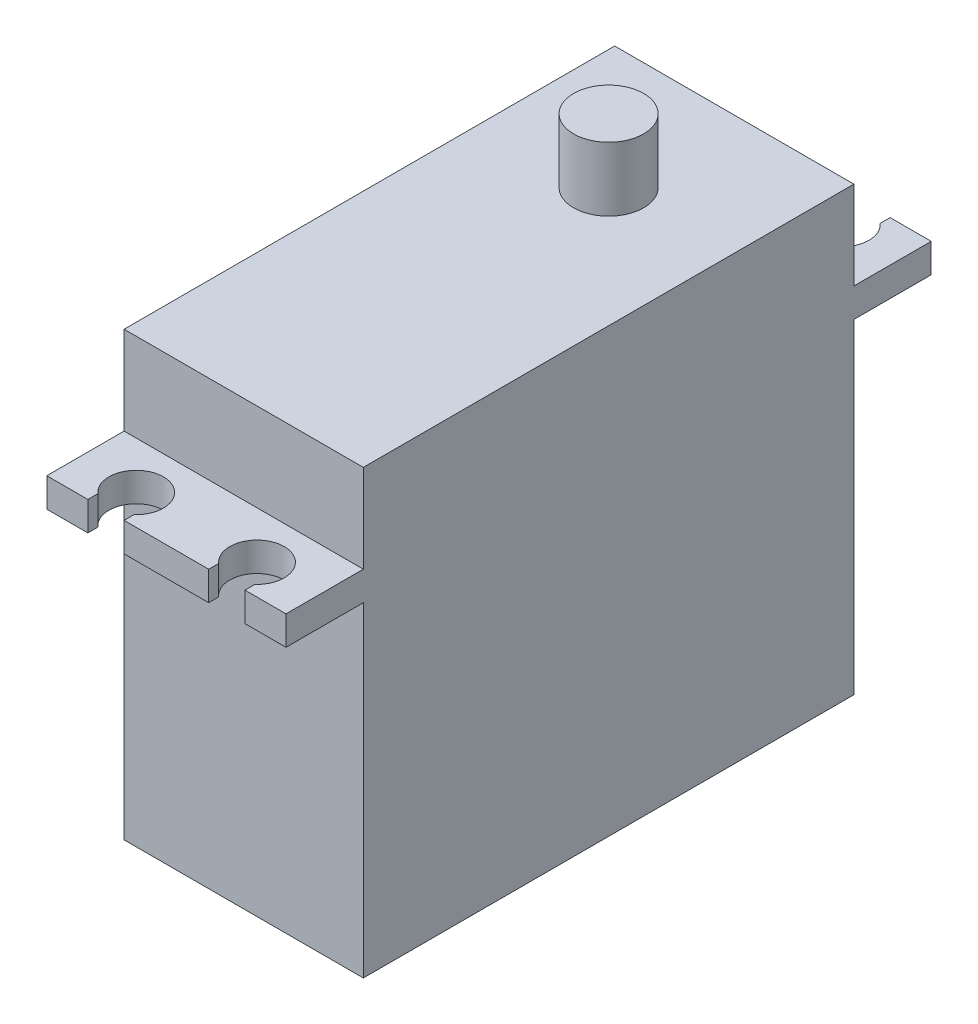
from build123d import *

# Parameters (mm, degrees)
SKETCH2_W           = 40.6
SKETCH2_H           = 36.6
SKETCH2_W_2         = 6.4
SKETCH2_H_2         = 2.4
SKETCH2_W_3         = 5.8
SKETCH2_H_3         = 5.3
BOSS_EXTRUDE1_DEPTH = 19.8
CUT_EXTRUDE1_DEPTH  = 5.3
CUT_EXTRUDE2_DEPTH  = 45.310495371


with BuildPart() as part:
    # Sketch2 → Boss-Extrude1 (new body)
    with BuildSketch(Plane(origin=(0, 0, 0), x_dir=(0, 0, -1), z_dir=(1, 0, 0))):
        Rectangle(SKETCH2_W, SKETCH2_H)
        with Locations((-23.5, 9.8)):
            Rectangle(SKETCH2_W_2, SKETCH2_H_2)
        with Locations((9.9, 20.95)):
            Rectangle(SKETCH2_W_3, SKETCH2_H_3)
        with Locations((23.5, 9.8)):
            Rectangle(SKETCH2_W_2, SKETCH2_H_2)
    extrude(amount=BOSS_EXTRUDE1_DEPTH)

    # Sketch3 → Cut-Extrude1 (cut)
    with BuildSketch(Plane(origin=(0, 18.3, 0), x_dir=(1, 0, 0), z_dir=(0, 1, 0))):
        with BuildLine():
            Line((9.9, 7), (12.8, 7))
            Line((12.8, 7), (12.8, 9.9))
            ThreePointArc((12.8, 9.9), (11.950609665, 7.849390335), (9.9, 7))
        make_face()
        with BuildLine():
            ThreePointArc((9.9, 12.8), (11.950609665, 11.950609665), (12.8, 9.9))
            Line((12.8, 9.9), (12.8, 12.8))
            Line((12.8, 12.8), (9.9, 12.8))
        make_face()
        with BuildLine():
            ThreePointArc((7, 9.9), (7.849390335, 11.950609665), (9.9, 12.8))
            Line((9.9, 12.8), (7, 12.8))
            Line((7, 12.8), (7, 9.9))
        make_face()
        with BuildLine():
            Line((7, 7), (9.9, 7))
            ThreePointArc((9.9, 7), (7.849390335, 7.849390335), (7, 9.9))
            Line((7, 9.9), (7, 7))
        make_face()
        Polygon((0, 7), (7, 7), (7, 9.9), (7, 12.8), (0, 12.8), align=None)
        Polygon((12.8, 7), (19.8, 7), (19.8, 12.8), (12.8, 12.8), (12.8, 9.9), align=None)
    extrude(amount=CUT_EXTRUDE1_DEPTH, mode=Mode.SUBTRACT)

    # Sketch4 → Cut-Extrude2 (cut, through all)
    with BuildSketch(Plane(origin=(0, 11, 0), x_dir=(1, 0, 0), z_dir=(0, 1, 0))):
        with BuildLine():
            ThreePointArc((16.4, 25.877050983), (14.9, 26.45), (13.4, 25.877050983))
            Line((13.4, 25.877050983), (16.4, 25.877050983))
        make_face()
        with BuildLine():
            Line((16.4, 25.877050983), (13.4, 25.877050983))
            ThreePointArc((13.4, 25.877050983), (13.981441346, 22.146040409), (17.15, 24.2))
            ThreePointArc((17.15, 24.2), (16.953959591, 25.118558654), (16.4, 25.877050983))
        make_face()
        with BuildLine():
            Line((16.4, 26.7), (13.4, 26.7))
            Line((13.4, 26.7), (13.4, 25.877050983))
            ThreePointArc((13.4, 25.877050983), (14.9, 26.45), (16.4, 25.877050983))
            Line((16.4, 25.877050983), (16.4, 26.7))
        make_face()
        with BuildLine():
            ThreePointArc((7.15, 24.2), (6.953959591, 25.118558654), (6.4, 25.877050983))
            Line((6.4, 25.877050983), (3.4, 25.877050983))
            ThreePointArc((3.4, 25.877050983), (3.981441346, 22.146040409), (7.15, 24.2))
        make_face()
        with BuildLine():
            Line((3.4, 25.877050983), (6.4, 25.877050983))
            ThreePointArc((6.4, 25.877050983), (4.9, 26.45), (3.4, 25.877050983))
        make_face()
        with BuildLine():
            Line((6.4, 25.877050983), (6.4, 26.7))
            Line((6.4, 26.7), (3.4, 26.7))
            Line((3.4, 26.7), (3.4, 25.877050983))
            ThreePointArc((3.4, 25.877050983), (4.9, 26.45), (6.4, 25.877050983))
        make_face()
        with BuildLine():
            ThreePointArc((13.4, -25.877050983), (14.9, -26.45), (16.4, -25.877050983))
            Line((16.4, -25.877050983), (13.4, -25.877050983))
        make_face()
        with BuildLine():
            Line((13.4, -25.877050983), (16.4, -25.877050983))
            ThreePointArc((16.4, -25.877050983), (16.953959591, -25.118558654), (17.15, -24.2))
            ThreePointArc((17.15, -24.2), (13.981441346, -22.146040409), (13.4, -25.877050983))
        make_face()
        with BuildLine():
            Line((13.4, -26.7), (16.4, -26.7))
            Line((16.4, -26.7), (16.4, -25.877050983))
            ThreePointArc((16.4, -25.877050983), (14.9, -26.45), (13.4, -25.877050983))
            Line((13.4, -25.877050983), (13.4, -26.7))
        make_face()
        with BuildLine():
            ThreePointArc((3.4, -25.877050983), (4.9, -26.45), (6.4, -25.877050983))
            Line((6.4, -25.877050983), (3.4, -25.877050983))
        make_face()
        with BuildLine():
            Line((3.4, -25.877050983), (6.4, -25.877050983))
            ThreePointArc((6.4, -25.877050983), (6.953959591, -25.118558654), (7.15, -24.2))
            ThreePointArc((7.15, -24.2), (3.981441346, -22.146040409), (3.4, -25.877050983))
        make_face()
        with BuildLine():
            Line((3.4, -26.7), (6.4, -26.7))
            Line((6.4, -26.7), (6.4, -25.877050983))
            ThreePointArc((6.4, -25.877050983), (4.9, -26.45), (3.4, -25.877050983))
            Line((3.4, -25.877050983), (3.4, -26.7))
        make_face()
    extrude(amount=-CUT_EXTRUDE2_DEPTH, mode=Mode.SUBTRACT)


solid = part.part
